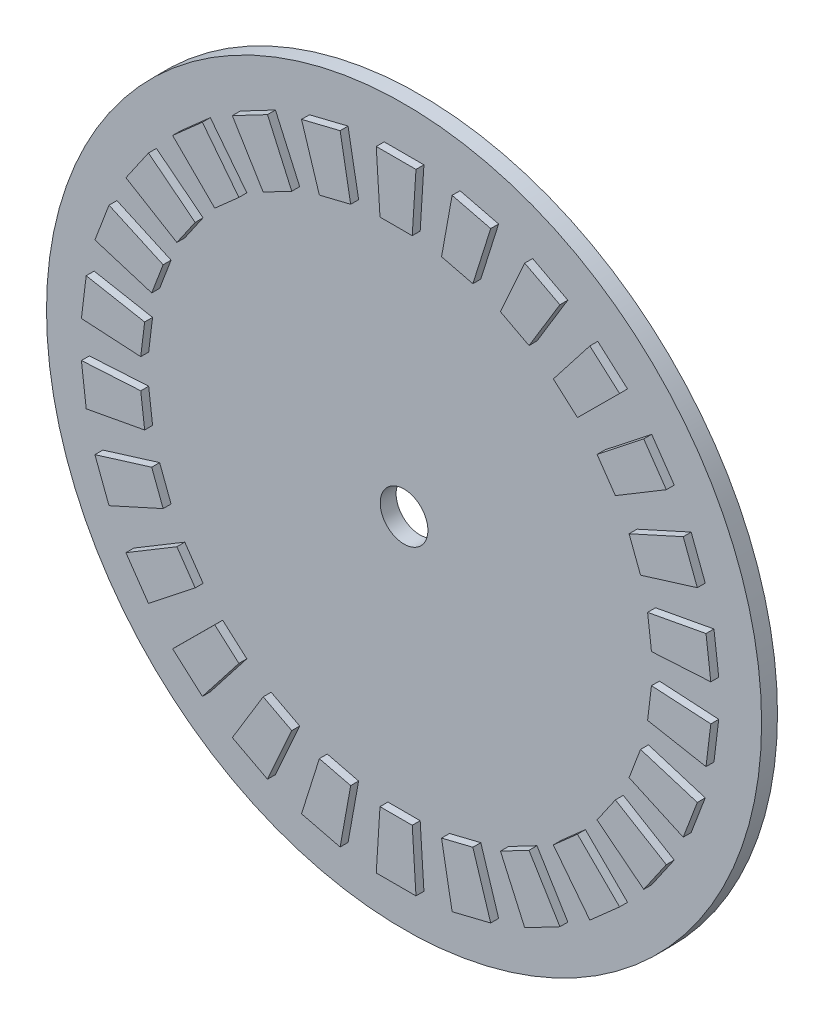
from build123d import *

# Parameters (mm, degrees)
SKETCH1_R           = 45
SKETCH1_R_2         = 3
BOSS_EXTRUDE1_DEPTH = 2
BOSS_EXTRUDE2_DEPTH = 1


with BuildPart() as part:
    # Sketch1 → Boss-Extrude1 (new body)
    with BuildSketch(Plane.XY):
        Circle(SKETCH1_R)
        Circle(SKETCH1_R_2, mode=Mode.SUBTRACT)
    extrude(amount=BOSS_EXTRUDE1_DEPTH)

    # Sketch2 → Boss-Extrude2 (add)
    with BuildSketch(Plane.XY.offset(2)):
        Polygon((2.5, 39.592009569), (-2.5, 39.592009569), (-2.028723843, 32.128501517), (2.028723843, 32.128501517), align=None)
        Polygon((11.902342614, 37.843248566), (7.047633527, 39.039826887), (5.719080868, 31.680411048), (9.658626498, 30.70940026), align=None)
        Polygon((20.612964339, 33.895175511), (16.18568421, 36.218791371), (13.134513387, 29.391170243), (16.727204889, 27.505580284), align=None)
        Polygon((28.125635501, 27.977238059), (24.38308176, 31.29285135), (19.78661573, 25.393821456), (22.823658933, 22.703235961), align=None)
        Polygon((34.003746961, 20.433365224), (31.163423227, 24.548284553), (25.288791888, 19.920676068), (27.59368488, 16.581462086), align=None)
        Polygon((37.905684245, 11.701979474), (36.13265981, 16.377060688), (29.321275383, 13.289813396), (30.760066161, 9.496033907), align=None)
        Polygon((39.604680943, 2.290517213), (39.001997542, 7.254061583), (31.64971293, 5.886595076), (32.138784205, 1.858730753), align=None)
        Polygon((39.001997542, -7.254061583), (39.604680943, -2.290517213), (32.138784205, -1.858730753), (31.64971293, -5.886595076), align=None)
        Polygon((36.13265981, -16.377060688), (37.905684245, -11.701979474), (30.760066161, -9.496033907), (29.321275383, -13.289813396), align=None)
        Polygon((31.163423227, -24.548284553), (34.003746961, -20.433365224), (27.59368488, -16.581462086), (25.288791888, -19.920676068), align=None)
        Polygon((24.38308176, -31.29285135), (28.125635501, -27.977238059), (22.823658933, -22.703235961), (19.78661573, -25.393821456), align=None)
        Polygon((16.18568421, -36.218791371), (20.612964339, -33.895175511), (16.727204889, -27.505580284), (13.134513387, -29.391170243), align=None)
        Polygon((7.047633527, -39.039826887), (11.902342614, -37.843248566), (9.658626498, -30.70940026), (5.719080868, -31.680411048), align=None)
        Polygon((-2.5, -39.592009569), (2.5, -39.592009569), (2.028723843, -32.128501517), (-2.028723843, -32.128501517), align=None)
        Polygon((-11.902342614, -37.843248566), (-7.047633527, -39.039826887), (-5.719080868, -31.680411048), (-9.658626498, -30.70940026), align=None)
        Polygon((-20.612964339, -33.895175511), (-16.18568421, -36.218791371), (-13.134513387, -29.391170243), (-16.727204889, -27.505580284), align=None)
        Polygon((-28.125635501, -27.977238059), (-24.38308176, -31.29285135), (-19.78661573, -25.393821456), (-22.823658933, -22.703235961), align=None)
        Polygon((-34.003746961, -20.433365224), (-31.163423227, -24.548284553), (-25.288791888, -19.920676068), (-27.59368488, -16.581462086), align=None)
        Polygon((-37.905684245, -11.701979474), (-36.13265981, -16.377060688), (-29.321275383, -13.289813396), (-30.760066161, -9.496033907), align=None)
        Polygon((-39.604680943, -2.290517213), (-39.001997542, -7.254061583), (-31.64971293, -5.886595076), (-32.138784205, -1.858730753), align=None)
        Polygon((-39.001997542, 7.254061583), (-39.604680943, 2.290517213), (-32.138784205, 1.858730753), (-31.64971293, 5.886595076), align=None)
        Polygon((-36.13265981, 16.377060688), (-37.905684245, 11.701979474), (-30.760066161, 9.496033907), (-29.321275383, 13.289813396), align=None)
        Polygon((-31.163423227, 24.548284553), (-34.003746961, 20.433365224), (-27.59368488, 16.581462086), (-25.288791888, 19.920676068), align=None)
        Polygon((-24.38308176, 31.29285135), (-28.125635501, 27.977238059), (-22.823658933, 22.703235961), (-19.78661573, 25.393821456), align=None)
        Polygon((-16.18568421, 36.218791371), (-20.612964339, 33.895175511), (-16.727204889, 27.505580284), (-13.134513387, 29.391170243), align=None)
        Polygon((-7.047633527, 39.039826887), (-11.902342614, 37.843248566), (-9.658626498, 30.70940026), (-5.719080868, 31.680411048), align=None)
    extrude(amount=BOSS_EXTRUDE2_DEPTH)


solid = part.part
